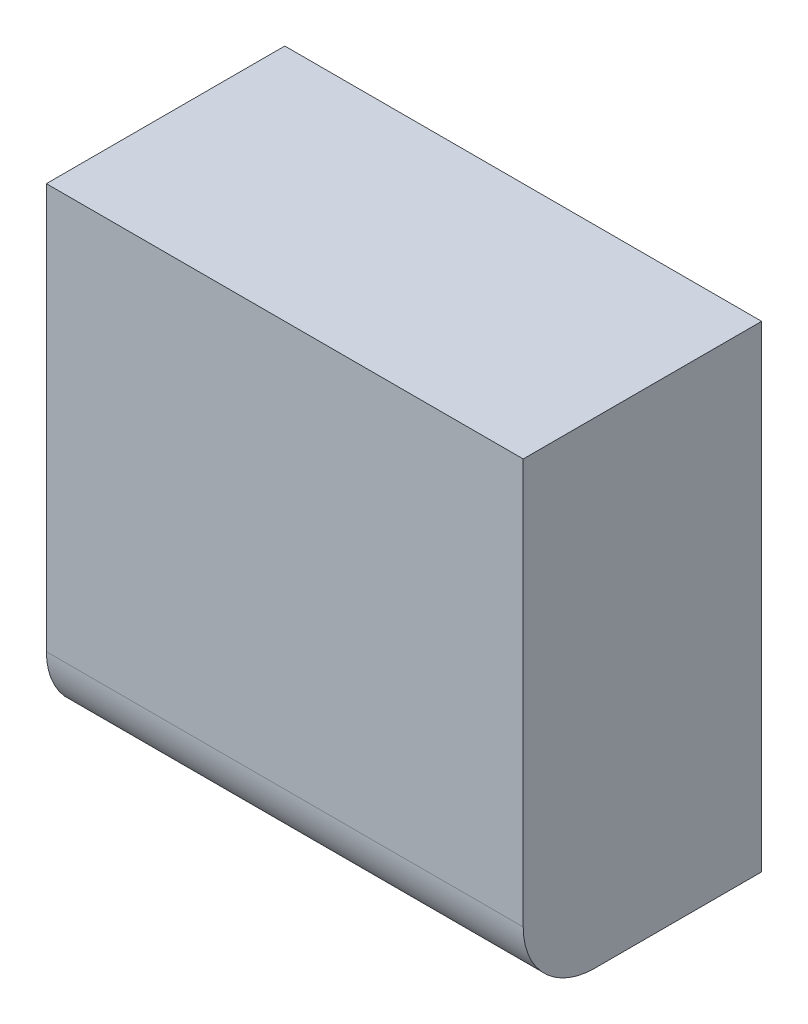
from build123d import *

# Parameters (mm, degrees)
SKETCH1_W           = 20
SKETCH1_H           = 20
BOSS_EXTRUDE1_DEPTH = 10
FILLET1_R           = 3


with BuildPart() as part:
    # Sketch1 → Boss-Extrude1 (new body)
    with BuildSketch(Plane.XY):
        with Locations((10, 10)):
            Rectangle(SKETCH1_W, SKETCH1_H)
    extrude(amount=BOSS_EXTRUDE1_DEPTH)

    # Fillet1
    fillet1_edges = [part.edges().sort_by_distance(p)[0] for p in [
        (10, 0, 10),
    ]]
    fillet(fillet1_edges, radius=FILLET1_R)


solid = part.part
